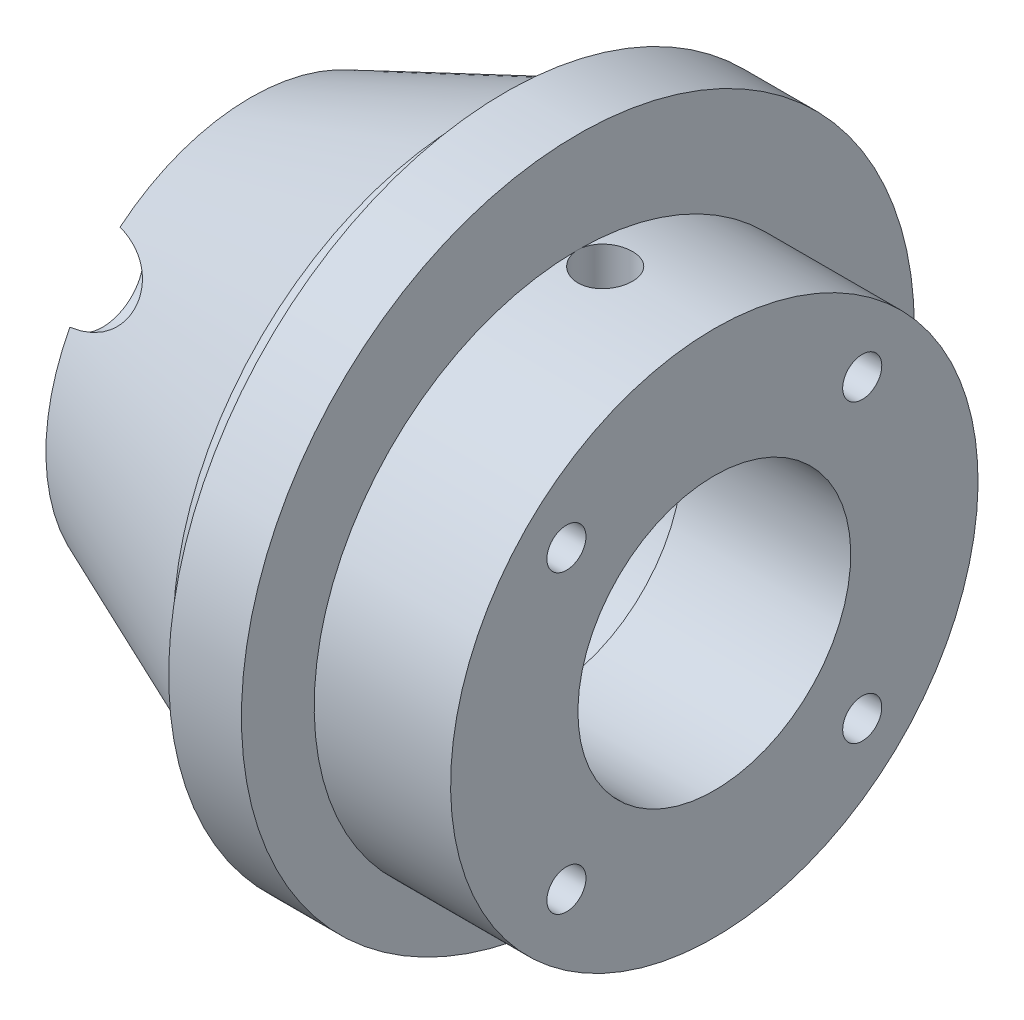
from build123d import *

# Parameters (mm, degrees)
ESQUISSE2_W                  = 15
ESQUISSE2_H                  = 29
ESQUISSE6_R                  = 4.5
ENL_V_MAT_EXTRU_1_DEPTH      = 15
ESQUISSE7_R                  = 2.15
ENL_V_MAT_EXTRU_2_DEPTH      = 66.306967469
R_P_TITION_CIRCULAIRE1_COUNT = 4
ESQUISSE14_W                 = 1.4
ESQUISSE14_H                 = 0.85
ESQUISSE15_R                 = 3
EXTRUSION1_DEPTH             = 75.632432697


with BuildPart() as part:
    # Esquisse2 → Base-Révolution (revolve)
    with BuildSketch(Plane.XY):
        with Locations((-7.5, 14.5)):
            Rectangle(ESQUISSE2_W, ESQUISSE2_H)
    revolve(axis=Axis((10, 0, 0), (-1, 0, 0)))

    # Esquisse4 → Boss.-Révol.1 (revolve)
    with BuildSketch(Plane.XY, mode=Mode.PRIVATE) as boss_r_vol_1_sk:
        Polygon((-15, 3), (-15, 40), (-23, 40), (-23, 35.5), (-27, 35.5), (-51, 25.5), (-51, 3), align=None)
    revolve(boss_r_vol_1_sk.sketch.rotate(Axis((-51, 3, 0), (-1, 0, 0)), 90), axis=Axis((-51, 3, 0), (-1, 0, 0)))

    # Esquisse6 → Enlèv. mat.-Extru.1 (cut)
    with BuildSketch(Plane.ZY.offset(51)):
        with Locations(Location((-16.263455967, 16.263455967, 0), (0, 0, 270))):
            Circle(ESQUISSE6_R)
    enl_v_mat_extru_1 = extrude(amount=-ENL_V_MAT_EXTRU_1_DEPTH, mode=Mode.SUBTRACT)

    # Esquisse7 → Enlèv. mat.-Extru.2 (cut, through all)
    with BuildSketch(Plane.ZY.offset(36)):
        with Locations(Location((-16.263455967, 16.263455967, 0), (0, 0, 270))):
            Circle(ESQUISSE7_R)
    enl_v_mat_extru_2 = extrude(amount=-ENL_V_MAT_EXTRU_2_DEPTH, mode=Mode.SUBTRACT)

    # Répétition circulaire1: Enlèv. mat.-Extru.1, Enlèv. mat.-Extru.2 ×4 about axis
    r_p_tition_circulaire1_axis = Axis((0, 0, 0), (1, 0, 0))
    add([enl_v_mat_extru_1.rotate(r_p_tition_circulaire1_axis, i * 360 / R_P_TITION_CIRCULAIRE1_COUNT) for i in range(1, R_P_TITION_CIRCULAIRE1_COUNT)], mode=Mode.SUBTRACT)
    add([enl_v_mat_extru_2.rotate(r_p_tition_circulaire1_axis, i * 360 / R_P_TITION_CIRCULAIRE1_COUNT) for i in range(1, R_P_TITION_CIRCULAIRE1_COUNT)], mode=Mode.SUBTRACT)

    # Esquisse13 → Enlèvement de matière-Révolution1 (revolve, cut)
    with BuildSketch(Plane.XY):
        Polygon((3, 0), (3, 15), (-18.5, 15), (-18.5, 16), (-51, 16), (-51, 0), align=None)
    revolve(axis=Axis((3, 0, 0), (-1, 0, 0)), mode=Mode.SUBTRACT)

    # Esquisse14 → Enlèvement de matière-Révolution2 (revolve, cut)
    with BuildSketch(Plane.XY):
        with Locations((-49.1, 16.425)):
            Rectangle(ESQUISSE14_W, ESQUISSE14_H)
    revolve(axis=Axis((-44.664297448, 0, 0), (-1, 0, 0)), mode=Mode.SUBTRACT)

    # Esquisse15 → Extrusion1 (cut, through all)
    with BuildSketch(Plane(origin=(0, 0, 0), x_dir=(1, 0, 0), z_dir=(0, 1, 0))):
        with Locations(Location((-12, 0, 0), (0, 0, 180))):
            Circle(ESQUISSE15_R)
    extrude(amount=EXTRUSION1_DEPTH, mode=Mode.SUBTRACT)


solid = part.part
